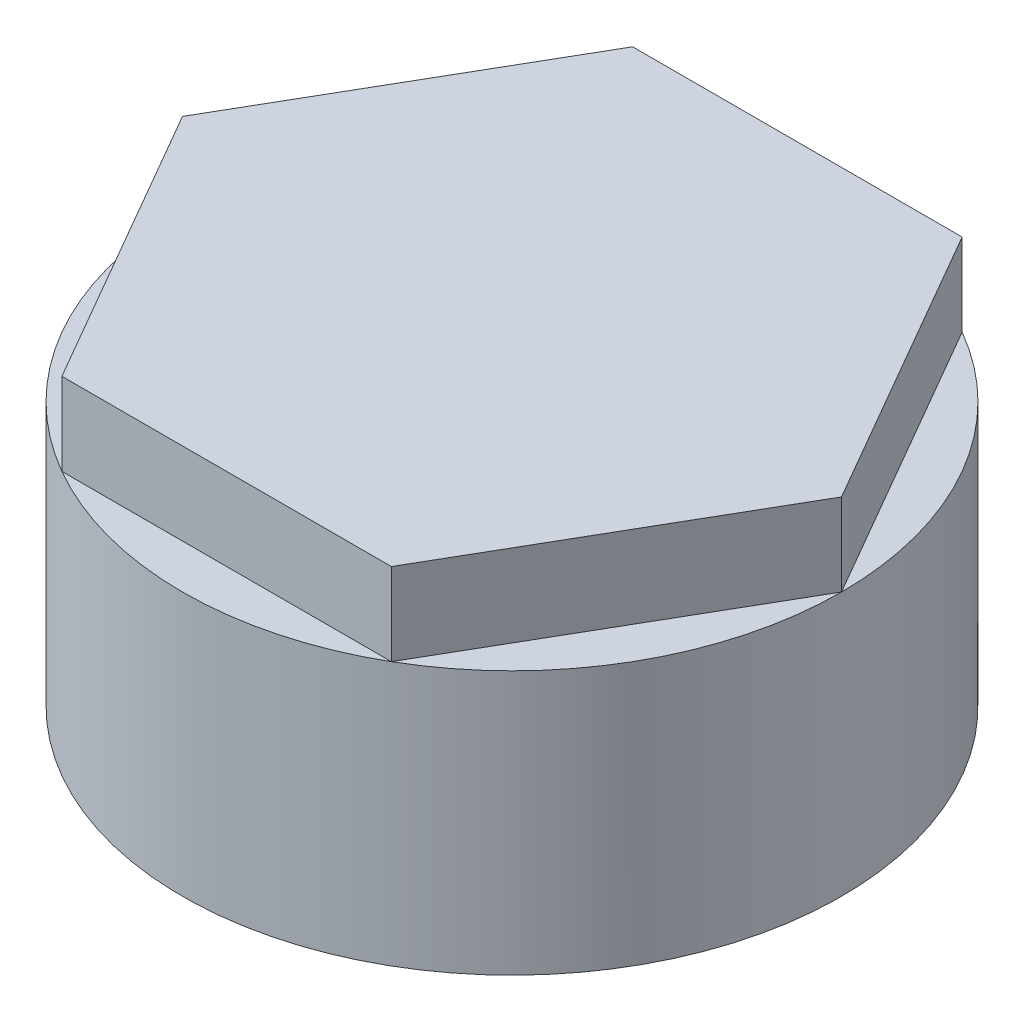
from build123d import *

# Parameters (mm, degrees)
TAGLIO_ESTRUSIONE1_START = -5
TAGLIO_ESTRUSIONE1_DEPTH = 5


with BuildPart() as part:
    # Schizzo1 → Rivoluzione1 (revolve)
    with BuildSketch(Plane.XY, mode=Mode.PRIVATE) as rivoluzione1_sk:
        Polygon((-15.5465, 0), (-15.5465, 15), (0, 15), (0, 21), (-20, 21), (-20, 0), align=None)
    revolve(rivoluzione1_sk.sketch.rotate(Axis((0, 0, 0), (0, 1, 0)), 270), axis=Axis((0, 0, 0), (0, 1, 0)))

    # Schizzo2 → Taglio-Estrusione1 (cut)
    with BuildSketch(Plane(origin=(0, 21, 0), x_dir=(1, 0, 0), z_dir=(0, 1, 0)).offset(TAGLIO_ESTRUSIONE1_START)):
        with BuildLine():
            Line((-20, 0), (-10, 17.320508076))
            ThreePointArc((-10, 17.320508076), (-17.320508076, 10), (-20, 0))
        make_face()
        with BuildLine():
            Line((-10, -17.320508076), (-20, 0))
            ThreePointArc((-20, 0), (-17.320508076, -10), (-10, -17.320508076))
        make_face()
        with BuildLine():
            Line((10, -17.320508076), (-10, -17.320508076))
            ThreePointArc((-10, -17.320508076), (0, -20), (10, -17.320508076))
        make_face()
        with BuildLine():
            ThreePointArc((10, -17.320508076), (17.320508076, -10), (20, 0))
            Line((20, 0), (10, -17.320508076))
        make_face()
        with BuildLine():
            ThreePointArc((20, 0), (17.320508076, 10), (10, 17.320508076))
            Line((10, 17.320508076), (20, 0))
        make_face()
        with BuildLine():
            ThreePointArc((10, 17.320508076), (0, 20), (-10, 17.320508076))
            Line((-10, 17.320508076), (10, 17.320508076))
        make_face()
    extrude(amount=TAGLIO_ESTRUSIONE1_DEPTH, mode=Mode.SUBTRACT)


solid = part.part
